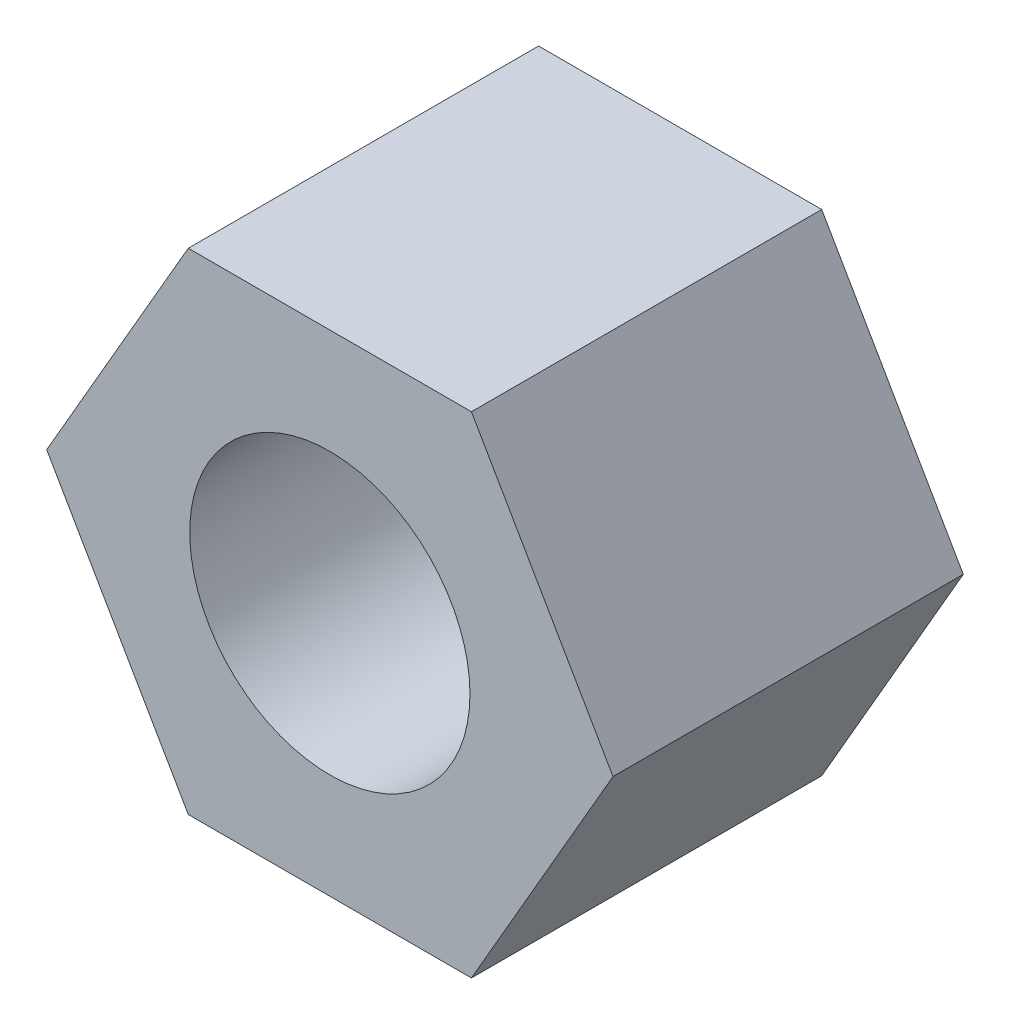
from build123d import *

# Parameters (mm, degrees)
SKETCH_1_R      = 2
EXTRUDE_4_DEPTH = 5


with BuildPart() as part:
    # Эскиз1 → Гайка_М4 (new body)
    with BuildSketch(Plane.XY):
        Polygon((-2.020725942, 3.5), (-4.041451884, 0), (-2.020725942, -3.5), (2.020725942, -3.5), (4.041451884, 0), (2.020725942, 3.5), align=None)
        Circle(SKETCH_1_R, mode=Mode.SUBTRACT)
    extrude(amount=EXTRUDE_4_DEPTH)


solid = part.part
